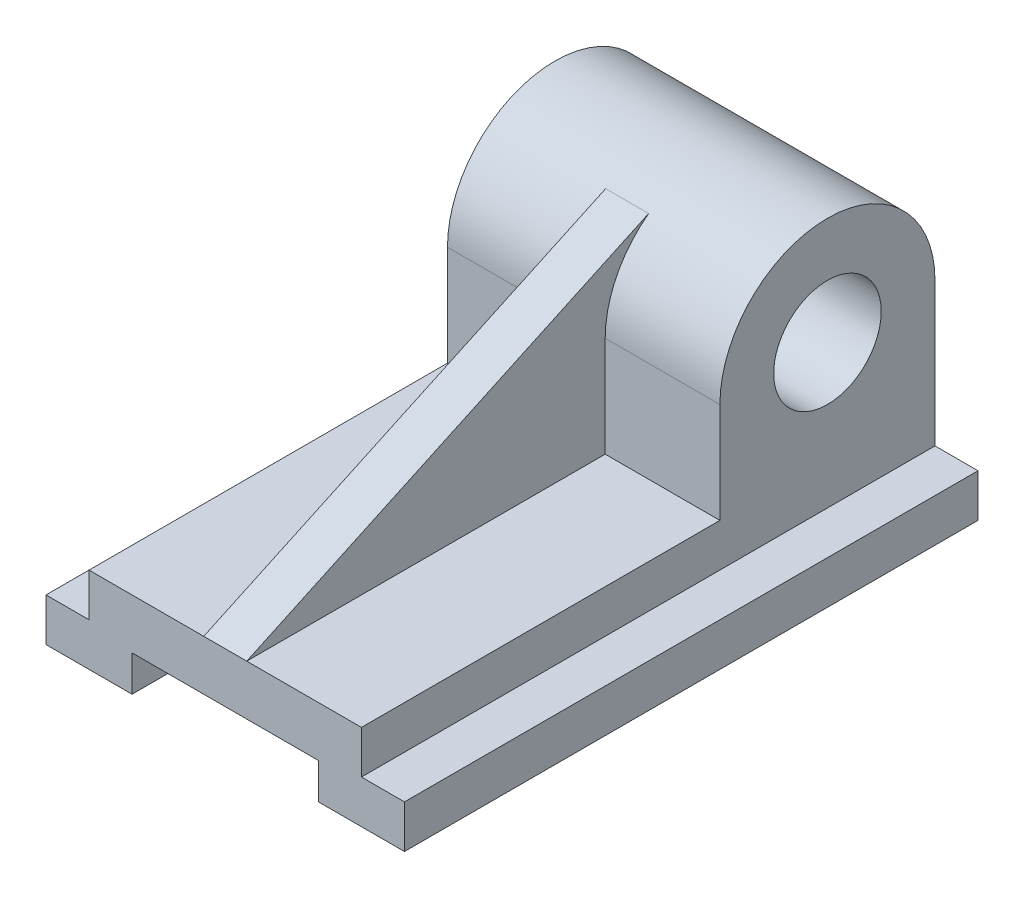
from build123d import *

# Parameters (mm, degrees)
BOSS_EXTRUDE1_DEPTH     = 160
SKETCH2_R               = 15
BOSS_EXTRUDE9_DEPTH     = 76
SKETCH6_W               = 12
SKETCH6_H               = 112.118263274
BOSS_EXTRUDE10_DEPTH    = 72
CUT_EXTRUDE6_DEPTH      = 183.439030912
CUT_EXTRUDE6_DEPTH_BACK = 183.439030912


with BuildPart() as part:
    # Sketch1 → Boss-Extrude1 (new body)
    with BuildSketch(Plane.XY):
        Polygon((0, 0), (-38, 0), (-38, -12), (-50, -12), (-50, -24), (-26, -24), (-26, -14), (26, -14), (26, -24), (50, -24), (50, -12), (38, -12), (38, 0), align=None)
    extrude(amount=BOSS_EXTRUDE1_DEPTH)

    # Sketch2 → Boss-Extrude9 (add)
    with BuildSketch(Plane(origin=(38, 0, 0), x_dir=(0, 0, -1), z_dir=(1, 0, 0))):
        with BuildLine():
            Line((-60, 0), (0, 0))
            Line((0, 0), (0, 28))
            ThreePointArc((0, 28), (-30, 58), (-60, 28))
            Line((-60, 28), (-60, 0))
        make_face()
        with Locations((-30, 28)):
            Circle(SKETCH2_R, mode=Mode.SUBTRACT)
    extrude(amount=-BOSS_EXTRUDE9_DEPTH)

    # Sketch6 → Boss-Extrude10 (add)
    with BuildSketch(Plane(origin=(0, 0, 0), x_dir=(1, 0, 0), z_dir=(0, 1, 0))):
        with Locations((0, -103.940868363)):
            Rectangle(SKETCH6_W, SKETCH6_H)
    extrude(amount=BOSS_EXTRUDE10_DEPTH)

    # Sketch7 → Cut-Extrude6 (cut, two sides: drawn at the far end of the back side and taken through both)
    with BuildSketch(Plane(origin=(0, 0, 0), x_dir=(0, 0, -1), z_dir=(1, 0, 0)).offset(-CUT_EXTRUDE6_DEPTH_BACK)):
        Polygon((-47.881736726, 52.088243848), (-160, 0), (-160, 72), (-47.881736726, 72), align=None)
    extrude(amount=CUT_EXTRUDE6_DEPTH + CUT_EXTRUDE6_DEPTH_BACK, mode=Mode.SUBTRACT)


solid = part.part
